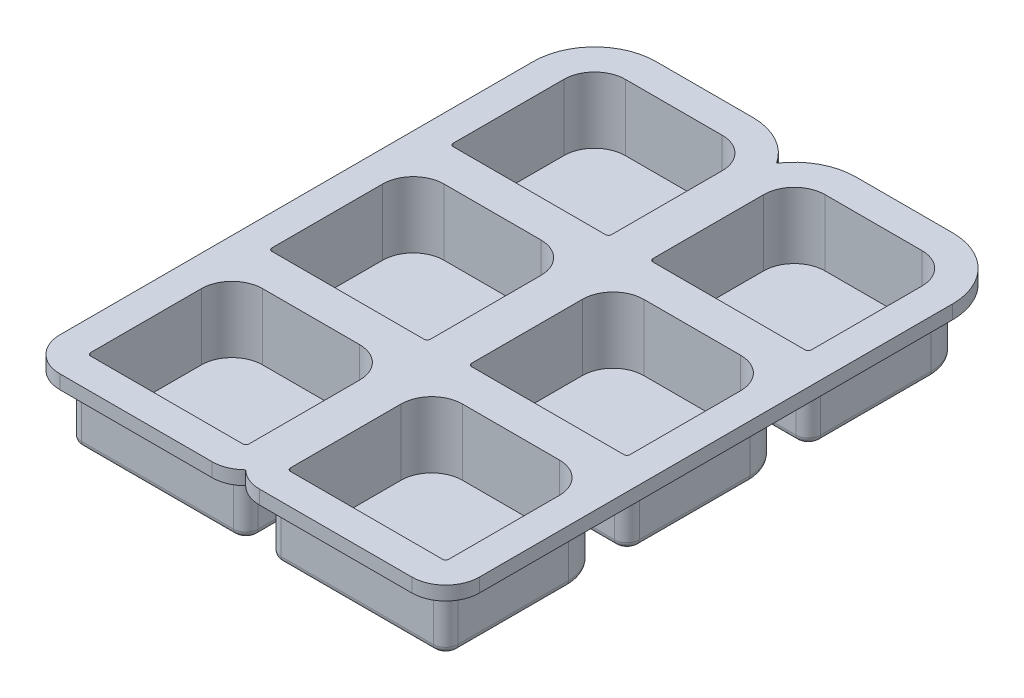
from build123d import *

# Parameters (mm, degrees)
SALIENTE_EXTRUIR1_DEPTH = 21.5
CORTAR_EXTRUIR1_DEPTH   = 17
SALIENTE_EXTRUIR2_START = 3
SALIENTE_EXTRUIR2_DEPTH = 3
REDONDEO2_R             = 2


with BuildPart() as part:
    # Croquis1 → Saliente-Extruir1 (new body)
    with BuildSketch(Plane(origin=(0, 0, 0), x_dir=(1, 0, 0), z_dir=(0, 1, 0))):
        with BuildLine():
            Line((-48.265, 92.5), (-16.735, 92.5))
            ThreePointArc((-16.735, 92.5), (-7.222745757, 90.093095783), (0, 83.451701923))
            ThreePointArc((0, 83.451701923), (7.222745757, 90.093095783), (16.735, 92.5))
            Line((16.735, 92.5), (48.265, 92.5))
            ThreePointArc((48.265, 92.5), (62.407135624, 86.642135624), (68.265, 72.5))
            Line((68.265, 72.5), (68.265, 36.5))
            Line((68.265, 36.5), (68.265, -45.5))
            Line((68.265, -45.5), (68.265, -81.5))
            ThreePointArc((68.265, -81.5), (65.043174593, -89.278174593), (57.265, -92.5))
            Line((57.265, -92.5), (7.735, -92.5))
            ThreePointArc((7.735, -92.5), (3.553625788, -91.674286692), (0, -89.321110855))
            ThreePointArc((0, -89.321110855), (-3.553625788, -91.674286692), (-7.735, -92.5))
            Line((-7.735, -92.5), (-57.265, -92.5))
            ThreePointArc((-57.265, -92.5), (-65.043174593, -89.278174593), (-68.265, -81.5))
            Line((-68.265, -81.5), (-68.265, -45.5))
            Line((-68.265, -45.5), (-68.265, 36.5))
            Line((-68.265, 36.5), (-68.265, 72.5))
            ThreePointArc((-68.265, 72.5), (-62.407135624, 86.642135624), (-48.265, 92.5))
        make_face()
        with BuildLine():
            Line((-48.265, 82.5), (-16.735, 82.5))
            ThreePointArc((-16.735, 82.5), (-9.663932188, 79.571067812), (-6.735, 72.5))
            Line((-6.735, 72.5), (-6.735, 36.5))
            ThreePointArc((-6.735, 36.5), (-7.027893219, 35.792893219), (-7.735, 35.5))
            Line((-7.735, 35.5), (-57.265, 35.5))
            ThreePointArc((-57.265, 35.5), (-57.972106781, 35.792893219), (-58.265, 36.5))
            Line((-58.265, 36.5), (-58.265, 72.5))
            ThreePointArc((-58.265, 72.5), (-55.336067812, 79.571067812), (-48.265, 82.5))
        make_face(mode=Mode.SUBTRACT)
        with BuildLine():
            Line((16.735, 82.5), (48.265, 82.5))
            ThreePointArc((48.265, 82.5), (55.336067812, 79.571067812), (58.265, 72.5))
            Line((58.265, 72.5), (58.265, 36.5))
            ThreePointArc((58.265, 36.5), (57.972106781, 35.792893219), (57.265, 35.5))
            Line((57.265, 35.5), (7.735, 35.5))
            ThreePointArc((7.735, 35.5), (7.027893219, 35.792893219), (6.735, 36.5))
            Line((6.735, 36.5), (6.735, 72.5))
            ThreePointArc((6.735, 72.5), (9.663932188, 79.571067812), (16.735, 82.5))
        make_face(mode=Mode.SUBTRACT)
        with BuildLine():
            Line((16.735, 23.5), (48.265, 23.5))
            ThreePointArc((48.265, 23.5), (55.336067812, 20.571067812), (58.265, 13.5))
            Line((58.265, 13.5), (58.265, -22.5))
            ThreePointArc((58.265, -22.5), (57.972106781, -23.207106781), (57.265, -23.5))
            Line((57.265, -23.5), (7.735, -23.5))
            ThreePointArc((7.735, -23.5), (7.027893219, -23.207106781), (6.735, -22.5))
            Line((6.735, -22.5), (6.735, 13.5))
            ThreePointArc((6.735, 13.5), (9.663932188, 20.571067812), (16.735, 23.5))
        make_face(mode=Mode.SUBTRACT)
        with BuildLine():
            Line((16.735, -35.5), (48.265, -35.5))
            ThreePointArc((48.265, -35.5), (55.336067812, -38.428932188), (58.265, -45.5))
            Line((58.265, -45.5), (58.265, -81.5))
            ThreePointArc((58.265, -81.5), (57.972106781, -82.207106781), (57.265, -82.5))
            Line((57.265, -82.5), (7.735, -82.5))
            ThreePointArc((7.735, -82.5), (7.027893219, -82.207106781), (6.735, -81.5))
            Line((6.735, -81.5), (6.735, -45.5))
            ThreePointArc((6.735, -45.5), (9.663932188, -38.428932188), (16.735, -35.5))
        make_face(mode=Mode.SUBTRACT)
        with BuildLine():
            Line((-48.265, 23.5), (-16.735, 23.5))
            ThreePointArc((-16.735, 23.5), (-9.663932188, 20.571067812), (-6.735, 13.5))
            Line((-6.735, 13.5), (-6.735, -22.5))
            ThreePointArc((-6.735, -22.5), (-7.027893219, -23.207106781), (-7.735, -23.5))
            Line((-7.735, -23.5), (-57.265, -23.5))
            ThreePointArc((-57.265, -23.5), (-57.972106781, -23.207106781), (-58.265, -22.5))
            Line((-58.265, -22.5), (-58.265, 13.5))
            ThreePointArc((-58.265, 13.5), (-55.336067812, 20.571067812), (-48.265, 23.5))
        make_face(mode=Mode.SUBTRACT)
        with BuildLine():
            Line((-48.265, -35.5), (-16.735, -35.5))
            ThreePointArc((-16.735, -35.5), (-9.663932188, -38.428932188), (-6.735, -45.5))
            Line((-6.735, -45.5), (-6.735, -81.5))
            ThreePointArc((-6.735, -81.5), (-7.027893219, -82.207106781), (-7.735, -82.5))
            Line((-7.735, -82.5), (-57.265, -82.5))
            ThreePointArc((-57.265, -82.5), (-57.972106781, -82.207106781), (-58.265, -81.5))
            Line((-58.265, -81.5), (-58.265, -45.5))
            ThreePointArc((-58.265, -45.5), (-55.336067812, -38.428932188), (-48.265, -35.5))
        make_face(mode=Mode.SUBTRACT)
    extrude(amount=SALIENTE_EXTRUIR1_DEPTH)

    # Croquis2 → Cortar-Extruir1 (cut)
    with BuildSketch(Plane.XZ):
        with BuildLine():
            Line((-48.265, -92.5), (-16.735, -92.5))
            ThreePointArc((-16.735, -92.5), (-7.222745757, -90.093095783), (0, -83.451701923))
            ThreePointArc((0, -83.451701923), (7.222745757, -90.093095783), (16.735, -92.5))
            Line((16.735, -92.5), (48.265, -92.5))
            ThreePointArc((48.265, -92.5), (62.407135624, -86.642135624), (68.265, -72.5))
            Line((68.265, -72.5), (68.265, 81.5))
            ThreePointArc((68.265, 81.5), (65.043174593, 89.278174593), (57.265, 92.5))
            Line((57.265, 92.5), (7.735, 92.5))
            ThreePointArc((7.735, 92.5), (3.553625788, 91.674286692), (0, 89.321110855))
            ThreePointArc((0, 89.321110855), (-3.553625788, 91.674286692), (-7.735, 92.5))
            Line((-7.735, 92.5), (-57.265, 92.5))
            ThreePointArc((-57.265, 92.5), (-65.043174593, 89.278174593), (-68.265, 81.5))
            Line((-68.265, 81.5), (-68.265, -72.5))
            ThreePointArc((-68.265, -72.5), (-62.407135624, -86.642135624), (-48.265, -92.5))
        make_face()
        with BuildLine():
            Line((61.265, -72.5), (61.265, -36.5))
            ThreePointArc((61.265, -36.5), (60.093427125, -33.671572875), (57.265, -32.5))
            Line((57.265, -32.5), (7.735, -32.5))
            ThreePointArc((7.735, -32.5), (4.906572875, -33.671572875), (3.735, -36.5))
            Line((3.735, -36.5), (3.735, -72.5))
            ThreePointArc((3.735, -72.5), (7.542611845, -81.692388155), (16.735, -85.5))
            Line((16.735, -85.5), (48.265, -85.5))
            ThreePointArc((48.265, -85.5), (57.457388155, -81.692388155), (61.265, -72.5))
        make_face(mode=Mode.SUBTRACT)
        with BuildLine():
            Line((-3.735, -72.5), (-3.735, -36.5))
            ThreePointArc((-3.735, -36.5), (-4.906572875, -33.671572875), (-7.735, -32.5))
            Line((-7.735, -32.5), (-57.265, -32.5))
            ThreePointArc((-57.265, -32.5), (-60.093427125, -33.671572875), (-61.265, -36.5))
            Line((-61.265, -36.5), (-61.265, -72.5))
            ThreePointArc((-61.265, -72.5), (-57.457388155, -81.692388155), (-48.265, -85.5))
            Line((-48.265, -85.5), (-16.735, -85.5))
            ThreePointArc((-16.735, -85.5), (-7.542611845, -81.692388155), (-3.735, -72.5))
        make_face(mode=Mode.SUBTRACT)
        with BuildLine():
            Line((-48.265, 32.5), (-16.735, 32.5))
            ThreePointArc((-16.735, 32.5), (-7.542611845, 36.307611845), (-3.735, 45.5))
            Line((-3.735, 45.5), (-3.735, 81.5))
            ThreePointArc((-3.735, 81.5), (-4.906572875, 84.328427125), (-7.735, 85.5))
            Line((-7.735, 85.5), (-57.265, 85.5))
            ThreePointArc((-57.265, 85.5), (-60.093427125, 84.328427125), (-61.265, 81.5))
            Line((-61.265, 81.5), (-61.265, 45.5))
            ThreePointArc((-61.265, 45.5), (-57.457388155, 36.307611845), (-48.265, 32.5))
        make_face(mode=Mode.SUBTRACT)
        with BuildLine():
            Line((16.735, 32.5), (48.265, 32.5))
            ThreePointArc((48.265, 32.5), (57.457388155, 36.307611845), (61.265, 45.5))
            Line((61.265, 45.5), (61.265, 81.5))
            ThreePointArc((61.265, 81.5), (60.093427125, 84.328427125), (57.265, 85.5))
            Line((57.265, 85.5), (7.735, 85.5))
            ThreePointArc((7.735, 85.5), (4.906572875, 84.328427125), (3.735, 81.5))
            Line((3.735, 81.5), (3.735, 45.5))
            ThreePointArc((3.735, 45.5), (7.542611845, 36.307611845), (16.735, 32.5))
        make_face(mode=Mode.SUBTRACT)
        with BuildLine():
            Line((-7.735, 26.5), (-57.265, 26.5))
            ThreePointArc((-57.265, 26.5), (-60.093427125, 25.328427125), (-61.265, 22.5))
            Line((-61.265, 22.5), (-61.265, -13.5))
            ThreePointArc((-61.265, -13.5), (-57.457388155, -22.692388155), (-48.265, -26.5))
            Line((-48.265, -26.5), (-16.735, -26.5))
            ThreePointArc((-16.735, -26.5), (-7.542611845, -22.692388155), (-3.735, -13.5))
            Line((-3.735, -13.5), (-3.735, 22.5))
            ThreePointArc((-3.735, 22.5), (-4.906572875, 25.328427125), (-7.735, 26.5))
        make_face(mode=Mode.SUBTRACT)
        with BuildLine():
            Line((57.265, 26.5), (7.735, 26.5))
            ThreePointArc((7.735, 26.5), (4.906572875, 25.328427125), (3.735, 22.5))
            Line((3.735, 22.5), (3.735, -13.5))
            ThreePointArc((3.735, -13.5), (7.542611845, -22.692388155), (16.735, -26.5))
            Line((16.735, -26.5), (48.265, -26.5))
            ThreePointArc((48.265, -26.5), (57.457388155, -22.692388155), (61.265, -13.5))
            Line((61.265, -13.5), (61.265, 22.5))
            ThreePointArc((61.265, 22.5), (60.093427125, 25.328427125), (57.265, 26.5))
        make_face(mode=Mode.SUBTRACT)
    extrude(amount=-CORTAR_EXTRUIR1_DEPTH, mode=Mode.SUBTRACT)

    # Croquis3 → Saliente-Extruir2 (add)
    with BuildSketch(Plane.XZ.offset(SALIENTE_EXTRUIR2_START)):
        with BuildLine():
            Line((61.265, 45.5), (61.265, 81.5))
            ThreePointArc((61.265, 81.5), (60.093427125, 84.328427125), (57.265, 85.5))
            Line((57.265, 85.5), (7.735, 85.5))
            ThreePointArc((7.735, 85.5), (4.906572875, 84.328427125), (3.735, 81.5))
            Line((3.735, 81.5), (3.735, 45.5))
            ThreePointArc((3.735, 45.5), (7.542611845, 36.307611845), (16.735, 32.5))
            Line((16.735, 32.5), (48.265, 32.5))
            ThreePointArc((48.265, 32.5), (57.457388155, 36.307611845), (61.265, 45.5))
        make_face()
        with BuildLine():
            Line((-48.265, 32.5), (-16.735, 32.5))
            ThreePointArc((-16.735, 32.5), (-7.542611845, 36.307611845), (-3.735, 45.5))
            Line((-3.735, 45.5), (-3.735, 81.5))
            ThreePointArc((-3.735, 81.5), (-4.906572875, 84.328427125), (-7.735, 85.5))
            Line((-7.735, 85.5), (-57.265, 85.5))
            ThreePointArc((-57.265, 85.5), (-60.093427125, 84.328427125), (-61.265, 81.5))
            Line((-61.265, 81.5), (-61.265, 45.5))
            ThreePointArc((-61.265, 45.5), (-57.457388155, 36.307611845), (-48.265, 32.5))
        make_face()
        with BuildLine():
            Line((-7.735, 26.5), (-57.265, 26.5))
            ThreePointArc((-57.265, 26.5), (-60.093427125, 25.328427125), (-61.265, 22.5))
            Line((-61.265, 22.5), (-61.265, -13.5))
            ThreePointArc((-61.265, -13.5), (-57.457388155, -22.692388155), (-48.265, -26.5))
            Line((-48.265, -26.5), (-16.735, -26.5))
            ThreePointArc((-16.735, -26.5), (-7.542611845, -22.692388155), (-3.735, -13.5))
            Line((-3.735, -13.5), (-3.735, 22.5))
            ThreePointArc((-3.735, 22.5), (-4.906572875, 25.328427125), (-7.735, 26.5))
        make_face()
        with BuildLine():
            Line((57.265, 26.5), (7.735, 26.5))
            ThreePointArc((7.735, 26.5), (4.906572875, 25.328427125), (3.735, 22.5))
            Line((3.735, 22.5), (3.735, -13.5))
            ThreePointArc((3.735, -13.5), (7.542611845, -22.692388155), (16.735, -26.5))
            Line((16.735, -26.5), (48.265, -26.5))
            ThreePointArc((48.265, -26.5), (57.457388155, -22.692388155), (61.265, -13.5))
            Line((61.265, -13.5), (61.265, 22.5))
            ThreePointArc((61.265, 22.5), (60.093427125, 25.328427125), (57.265, 26.5))
        make_face()
        with BuildLine():
            Line((-7.735, -32.5), (-57.265, -32.5))
            ThreePointArc((-57.265, -32.5), (-60.093427125, -33.671572875), (-61.265, -36.5))
            Line((-61.265, -36.5), (-61.265, -72.5))
            ThreePointArc((-61.265, -72.5), (-57.457388155, -81.692388155), (-48.265, -85.5))
            Line((-48.265, -85.5), (-16.735, -85.5))
            ThreePointArc((-16.735, -85.5), (-7.542611845, -81.692388155), (-3.735, -72.5))
            Line((-3.735, -72.5), (-3.735, -36.5))
            ThreePointArc((-3.735, -36.5), (-4.906572875, -33.671572875), (-7.735, -32.5))
        make_face()
        with BuildLine():
            Line((61.265, -72.5), (61.265, -36.5))
            ThreePointArc((61.265, -36.5), (60.093427125, -33.671572875), (57.265, -32.5))
            Line((57.265, -32.5), (7.735, -32.5))
            ThreePointArc((7.735, -32.5), (4.906572875, -33.671572875), (3.735, -36.5))
            Line((3.735, -36.5), (3.735, -72.5))
            ThreePointArc((3.735, -72.5), (7.542611845, -81.692388155), (16.735, -85.5))
            Line((16.735, -85.5), (48.265, -85.5))
            ThreePointArc((48.265, -85.5), (57.457388155, -81.692388155), (61.265, -72.5))
        make_face()
    extrude(amount=-SALIENTE_EXTRUIR2_DEPTH)

    # Redondeo2
    redondeo2_edges = [part.edges().sort_by_distance(p)[0] for p in [
        (-3.735, 17, -54.5),
        (-4.906572875, 17, -33.671572875),
        (-32.5, 17, -32.5),
        (-60.093427125, 17, -33.671572875),
        (-61.265, 17, -54.5),
        (-57.457388155, 17, -81.692388155),
        (-32.5, 17, -85.5),
        (-7.542611845, 17, -81.692388155),
        (-61.265, 17, 63.5),
        (-57.457388155, 17, 36.307611845),
        (-32.5, 17, 32.5),
        (-7.542611845, 17, 36.307611845),
        (-3.735, 17, 63.5),
        (-4.906572875, 17, 84.328427125),
        (-32.5, 17, 85.5),
        (-60.093427125, 17, 84.328427125),
        (61.265, 17, 4.5),
        (60.093427125, 17, 25.328427125),
        (32.5, 17, 26.5),
        (4.906572875, 17, 25.328427125),
        (3.735, 17, 4.5),
        (7.542611845, 17, -22.692388155),
        (32.5, 17, -26.5),
        (57.457388155, 17, -22.692388155),
        (32.5, 17, 32.5),
        (57.457388155, 17, 36.307611845),
        (61.265, 17, 63.5),
        (60.093427125, 17, 84.328427125),
        (32.5, 17, 85.5),
        (4.906572875, 17, 84.328427125),
        (3.735, 17, 63.5),
        (7.542611845, 17, 36.307611845),
        (-3.735, 17, 4.5),
        (-4.906572875, 17, 25.328427125),
        (-32.5, 17, 26.5),
        (-60.093427125, 17, 25.328427125),
        (-61.265, 17, 4.5),
        (-57.457388155, 17, -22.692388155),
        (-32.5, 17, -26.5),
        (-7.542611845, 17, -22.692388155),
        (32.5, 17, -85.5),
        (57.457388155, 17, -81.692388155),
        (61.265, 17, -54.5),
        (60.093427125, 17, -33.671572875),
        (32.5, 17, -32.5),
        (4.906572875, 17, -33.671572875),
        (3.735, 17, -54.5),
        (7.542611845, 17, -81.692388155),
        (-4.906572875, -3, -33.671572875),
        (-32.5, -3, -32.5),
        (-60.093427125, -3, -33.671572875),
        (-61.265, -3, -54.5),
        (-57.457388155, -3, -81.692388155),
        (-32.5, -3, -85.5),
        (-7.542611845, -3, -81.692388155),
        (-3.735, -3, -54.5),
        (60.093427125, -3, 25.328427125),
        (32.5, -3, 26.5),
        (4.906572875, -3, 25.328427125),
        (3.735, -3, 4.5),
        (7.542611845, -3, -22.692388155),
        (32.5, -3, -26.5),
        (57.457388155, -3, -22.692388155),
        (61.265, -3, 4.5),
        (-4.906572875, -3, 25.328427125),
        (-32.5, -3, 26.5),
        (-60.093427125, -3, 25.328427125),
        (-61.265, -3, 4.5),
        (-57.457388155, -3, -22.692388155),
        (-32.5, -3, -26.5),
        (-7.542611845, -3, -22.692388155),
        (-3.735, -3, 4.5),
        (-57.457388155, -3, 36.307611845),
        (-32.5, -3, 32.5),
        (-7.542611845, -3, 36.307611845),
        (-3.735, -3, 63.5),
        (-4.906572875, -3, 84.328427125),
        (-32.5, -3, 85.5),
        (-60.093427125, -3, 84.328427125),
        (-61.265, -3, 63.5),
        (57.457388155, -3, -81.692388155),
        (61.265, -3, -54.5),
        (60.093427125, -3, -33.671572875),
        (32.5, -3, -32.5),
        (4.906572875, -3, -33.671572875),
        (3.735, -3, -54.5),
        (7.542611845, -3, -81.692388155),
        (32.5, -3, -85.5),
        (57.457388155, -3, 36.307611845),
        (61.265, -3, 63.5),
        (60.093427125, -3, 84.328427125),
        (32.5, -3, 85.5),
        (4.906572875, -3, 84.328427125),
        (3.735, -3, 63.5),
        (7.542611845, -3, 36.307611845),
        (32.5, -3, 32.5),
    ]]
    fillet(redondeo2_edges, radius=REDONDEO2_R)


solid = part.part
